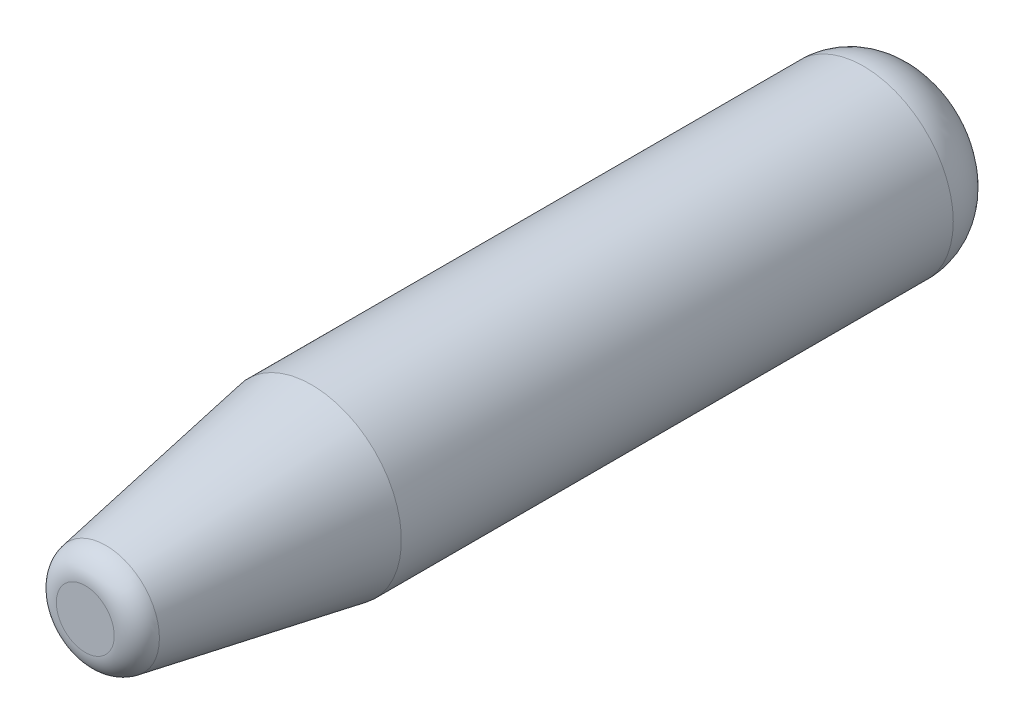
from build123d import *

# Parameters (mm, degrees)
SKETCH1_R           = 228.6
BOSS_EXTRUDE1_DEPTH = 2133.6
FILLET1_R           = 152.4
CHAMFER1_SIZE       = 101.6
CHAMFER1_SIZE2      = 576.202232873
FILLET2_R           = 63.5


with BuildPart() as part:
    # Sketch1 → Boss-Extrude1 (new body)
    with BuildSketch(Plane.XY):
        Circle(SKETCH1_R)
    extrude(amount=BOSS_EXTRUDE1_DEPTH)

    # Fillet1
    fillet1_edges = [part.edges().sort_by_distance(p)[0] for p in [
        (-228.6, 0, 0),
    ]]
    fillet(fillet1_edges, radius=FILLET1_R)

    # Chamfer1
    chamfer1_edges = [part.edges().sort_by_distance(p)[0] for p in [
        (-228.6, 0, 2133.6),
    ]]
    chamfer1_side = [part.faces().sort_by_distance(p)[0] for p in [
        (0, 0, 2133.6),
    ]]
    chamfer(chamfer1_edges, length=CHAMFER1_SIZE, length2=CHAMFER1_SIZE2, reference=chamfer1_side[0])

    # Fillet2
    fillet2_edges = [part.edges().sort_by_distance(p)[0] for p in [
        (-127, 0, 2133.6),
    ]]
    fillet(fillet2_edges, radius=FILLET2_R)


solid = part.part
